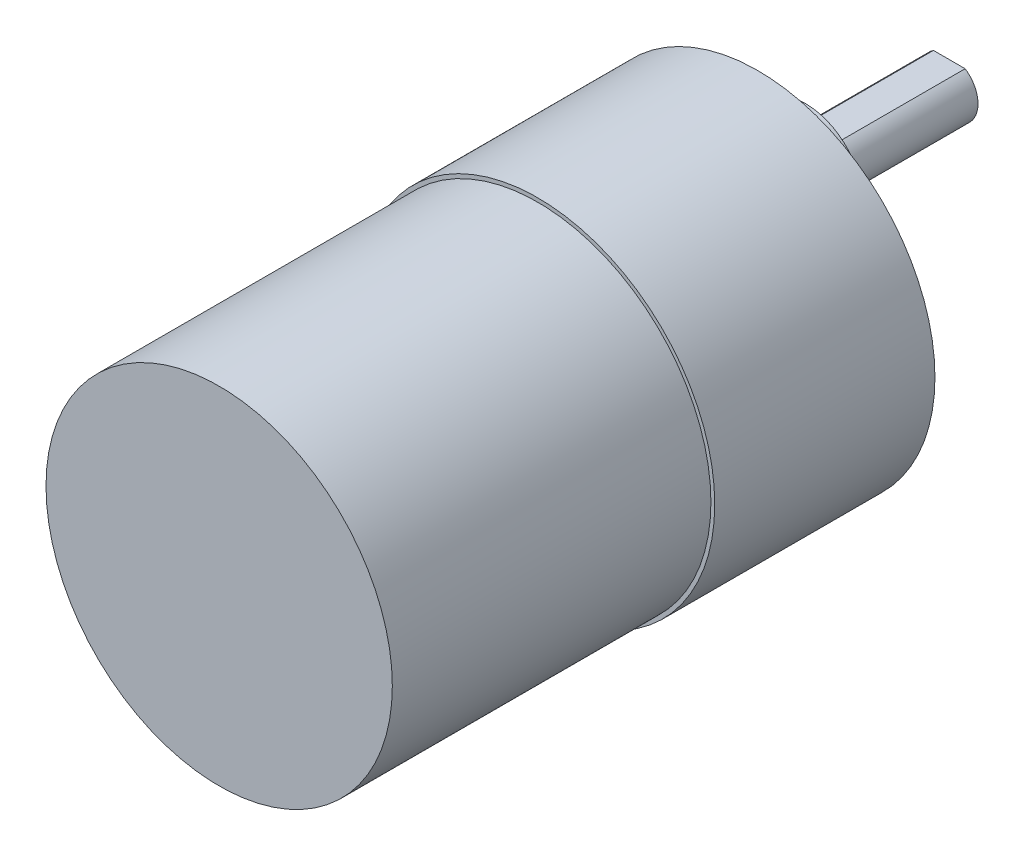
from build123d import *

# Parameters (mm, degrees)
SKETCH1_R           = 18.5
BOSS_EXTRUDE1_DEPTH = 23.016176471
SKETCH2_R           = 18.1
BOSS_EXTRUDE2_DEPTH = 33.3
SKETCH3_R           = 6
BOSS_EXTRUDE3_DEPTH = 5
BOSS_EXTRUDE4_DEPTH = 15
CUT_EXTRUDE1_START  = -14
CUT_EXTRUDE1_DEPTH  = 14
SKETCH6_R           = 1.5
CUT_EXTRUDE2_DEPTH  = 8


with BuildPart() as part:
    # Sketch1 → Boss-Extrude1 (new body)
    with BuildSketch(Plane.XY):
        Circle(SKETCH1_R)
    extrude(amount=BOSS_EXTRUDE1_DEPTH)

    # Sketch2 → Boss-Extrude2 (add)
    with BuildSketch(Plane.XY.offset(23.016176471)):
        Circle(SKETCH2_R)
    extrude(amount=BOSS_EXTRUDE2_DEPTH)

    # Sketch3 → Boss-Extrude3 (add)
    with BuildSketch(Plane(origin=(0, 0, 0), x_dir=(-1, 0, 0), z_dir=(0, 0, -1))):
        with Locations(Location((0, 7, 0), (0, 0, 180))):
            Circle(SKETCH3_R)
    extrude(amount=BOSS_EXTRUDE3_DEPTH)

    # Sketch4 → Boss-Extrude4 (add)
    with BuildSketch(Plane(origin=(0, 0, -5), x_dir=(-1, 0, 0), z_dir=(0, 0, -1))):
        with BuildLine():
            ThreePointArc((-1.658312395, 9.5), (0, 4), (1.658312395, 9.5))
            ThreePointArc((1.658312395, 9.5), (0, 10), (-1.658312395, 9.5))
        make_face()
    extrude(amount=BOSS_EXTRUDE4_DEPTH)

    # Sketch5 → Cut-Extrude1 (cut)
    with BuildSketch(Plane(origin=(0, 0, -20), x_dir=(-1, 0, 0), z_dir=(0, 0, -1)).offset(CUT_EXTRUDE1_START)):
        with BuildLine():
            Line((-1.658312395, 9.5), (1.658312395, 9.5))
            ThreePointArc((1.658312395, 9.5), (0, 10), (-1.658312395, 9.5))
        make_face()
    extrude(amount=CUT_EXTRUDE1_DEPTH, mode=Mode.SUBTRACT)

    # Sketch6 → Cut-Extrude2 (cut)
    with BuildSketch(Plane(origin=(0, 0, 0), x_dir=(-1, 0, 0), z_dir=(0, 0, -1))):
        with Locations((7.75, 13.423393759)):
            Circle(SKETCH6_R)
        with Locations((15.5, 0)):
            Circle(SKETCH6_R)
        with Locations((7.75, -13.423393759)):
            Circle(SKETCH6_R)
        with Locations((-7.75, -13.423393759)):
            Circle(SKETCH6_R)
        with Locations((-15.5, 0)):
            Circle(SKETCH6_R)
        with Locations((-7.75, 13.423393759)):
            Circle(SKETCH6_R)
    extrude(amount=-CUT_EXTRUDE2_DEPTH, mode=Mode.SUBTRACT)


solid = part.part
